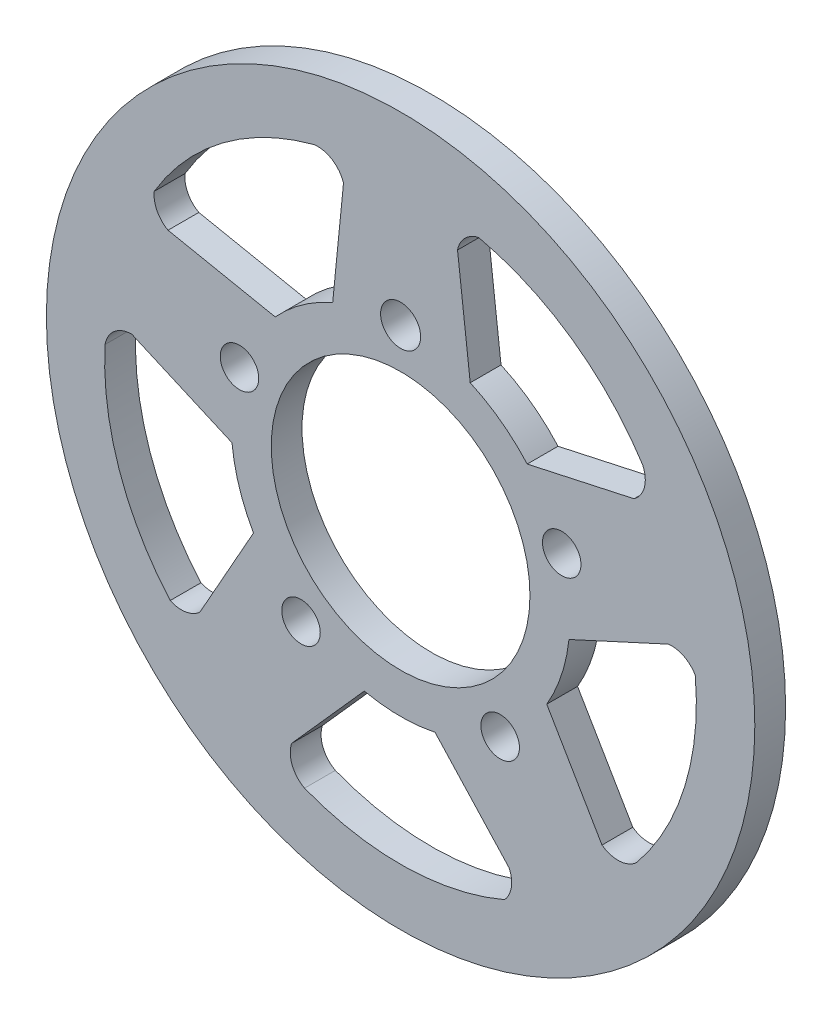
from build123d import *

# Parameters (mm, degrees)
SKETCH1_R           = 115
BOSS_EXTRUDE1_DEPTH = 10
SKETCH3_R           = 6.25
SKETCH3_R_2         = 6.5
SKETCH3_R_3         = 42
CUT_EXTRUDE2_DEPTH  = 163.941707368


with BuildPart() as part:
    # Sketch1 → Boss-Extrude1 (new body)
    with BuildSketch(Plane.XY):
        Circle(SKETCH1_R)
    extrude(amount=BOSS_EXTRUDE1_DEPTH)

    # Sketch3 → Cut-Extrude2 (cut, through all)
    with BuildSketch(Plane.XY):
        with BuildLine():
            Line((18.484325558, 85.403687954), (22.603174126, 50.140767041))
            ThreePointArc((22.603174126, 50.140767041), (32.574916184, 44.315627442), (41.110477128, 36.536675688))
            Line((41.110477128, 36.536675688), (75.793703221, 44.120364278))
            ThreePointArc((75.793703221, 44.120364278), (79.175021421, 49.09862209), (78.573775649, 55.086515471))
            ThreePointArc((78.573775649, 55.086515471), (55.629022762, 78.938176107), (25.371814654, 92.349542839))
            ThreePointArc((25.371814654, 92.349542839), (20.87622799, 89.919618918), (18.484325558, 85.403687954))
        make_face()
        with BuildLine():
            ThreePointArc((-40.701938294, 36.991245168), (-32.080463562, 44.674868301), (-22.044607418, 50.388840866))
            Line((-22.044607418, 50.388840866), (-18.539417586, 85.718037702))
            ThreePointArc((-18.539417586, 85.718037702), (-22.229137331, 90.472228676), (-28.109757511, 91.750770782))
            ThreePointArc((-28.109757511, 91.750770782), (-57.884353357, 77.299582515), (-79.989312588, 52.667607817))
            ThreePointArc((-79.989312588, 52.667607817), (-79.067530287, 47.641163039), (-75.511763217, 43.970829232))
            Line((-75.511763217, 43.970829232), (-40.701938294, 36.991245168))
        make_face()
        with BuildLine():
            ThreePointArc((-47.7583554, -27.278920241), (-52.40173304, -16.70504039), (-54.73479378, -5.394659379))
            Line((-54.73479378, -5.394659379), (-87.251693421, 8.856296471))
            ThreePointArc((-87.251693421, 8.856296471), (-92.913383832, 6.81629027), (-95.946561206, 1.618579367))
            ThreePointArc((-95.946561206, 1.618579367), (-91.403520553, -31.164406796), (-74.80792857, -59.799171102))
            ThreePointArc((-74.80792857, -59.799171102), (-69.742649114, -60.475760896), (-65.153161777, -58.228220975))
            Line((-65.153161777, -58.228220975), (-47.7583554, -27.278920241))
        make_face()
        with BuildLine():
            ThreePointArc((11.18565141, -53.850545053), (-0.305588527, -54.999151045), (-11.783355506, -53.72292372))
            Line((-11.783355506, -53.72292372), (-35.385094524, -80.244545469))
            ThreePointArc((-35.385094524, -80.244545469), (-35.194491887, -86.259529612), (-31.188478418, -90.75043372))
            ThreePointArc((-31.188478418, -90.75043372), (1.393870963, -96.560245154), (33.755470104, -89.625528057))
            ThreePointArc((33.755470104, -89.625528057), (35.964202669, -85.017238768), (35.244894765, -79.957848899))
            Line((35.244894765, -79.957848899), (11.18565141, -53.850545053))
        make_face()
        with BuildLine():
            Line((86.935704672, 8.811552688), (54.671468158, -6.002546915))
            ThreePointArc((54.671468158, -6.002546915), (52.212868944, -17.286304309), (47.452279576, -27.807933455))
            Line((47.452279576, -27.807933455), (65.38250231, -58.450152982))
            ThreePointArc((65.38250231, -58.450152982), (71.161991629, -60.127611424), (76.671021486, -57.7054319))
            ThreePointArc((76.671021486, -57.7054319), (92.264980185, -28.513106671), (95.6699564, 4.407548503))
            ThreePointArc((95.6699564, 4.407548503), (91.969748742, 7.932217708), (86.935704672, 8.811552688))
        make_face()
        with Locations((52.308108396, 16.995934691)):
            Circle(SKETCH3_R)
        with Locations((0, 55)):
            Circle(SKETCH3_R_2)
        with Locations((-52.308108396, 16.995934691)):
            Circle(SKETCH3_R)
        with Locations((-32.328188876, -44.495934691)):
            Circle(SKETCH3_R)
        with Locations((32.328188876, -44.495934691)):
            Circle(SKETCH3_R)
        Circle(SKETCH3_R_3)
    extrude(amount=CUT_EXTRUDE2_DEPTH, mode=Mode.SUBTRACT)


solid = part.part
